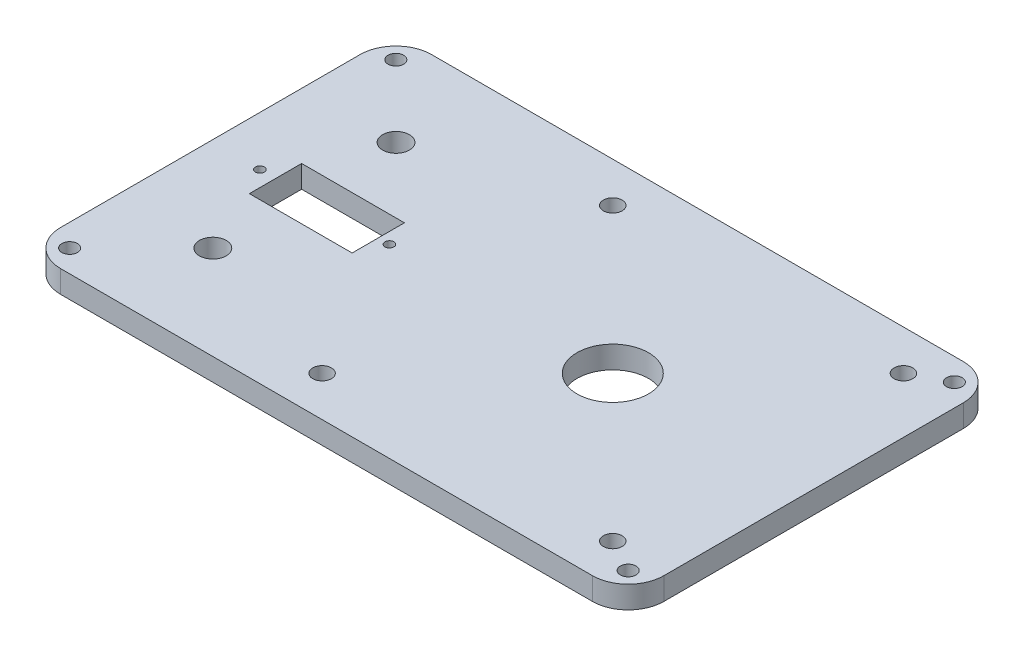
from build123d import *

# Parameters (mm, degrees)
SKETCH1_W           = 135
SKETCH1_H           = 83
SKETCH1_R           = 2.1
SKETCH1_R_2         = 8
SKETCH1_R_3         = 3
SKETCH1_R_4         = 4.725
SKETCH1_R_5         = 1.75
BOSS_EXTRUDE1_DEPTH = 5
SKETCH3_R           = 1
SKETCH3_W           = 23
SKETCH3_H           = 11.7
CUT_EXTRUDE1_DEPTH  = 80.394584198
FILLET1_R           = 8


with BuildPart() as part:
    # Sketch1 → Boss-Extrude1 (new body)
    with BuildSketch(Plane(origin=(0, 0, 0), x_dir=(1, 0, 0), z_dir=(0, 1, 0))):
        Rectangle(SKETCH1_W, SKETCH1_H)
        with Locations(Location((-9.98, 32.53, 0), (0, 0, 270))):
            Circle(SKETCH1_R, mode=Mode.SUBTRACT)
        with Locations(Location((55.08, 32.53, 0), (0, 0, 270))):
            Circle(SKETCH1_R, mode=Mode.SUBTRACT)
        with Locations(Location((55.08, -32.53, 0), (0, 0, 270))):
            Circle(SKETCH1_R, mode=Mode.SUBTRACT)
        with Locations(Location((-9.98, -32.53, 0), (0, 0, 270))):
            Circle(SKETCH1_R, mode=Mode.SUBTRACT)
        with Locations(Location((22.55, 0, 0), (0, 0, 270))):
            Circle(SKETCH1_R_2, mode=Mode.SUBTRACT)
        with Locations(Location((-46.455, 20.5, 0), (0, 0, 270))):
            Circle(SKETCH1_R_3, mode=Mode.SUBTRACT)
        with Locations(Location((-35.78, 0, 0), (0, 0, 270))):
            Circle(SKETCH1_R_4, mode=Mode.SUBTRACT)
        with Locations(Location((-46.455, -20.5, 0), (0, 0, 270))):
            Circle(SKETCH1_R_3, mode=Mode.SUBTRACT)
        with Locations(Location((-62.5, 36.5, 0), (0, 0, 270))):
            Circle(SKETCH1_R_5, mode=Mode.SUBTRACT)
        with Locations(Location((62.5, 36.5, 0), (0, 0, 270))):
            Circle(SKETCH1_R_5, mode=Mode.SUBTRACT)
        with Locations(Location((62.5, -36.5, 0), (0, 0, 270))):
            Circle(SKETCH1_R_5, mode=Mode.SUBTRACT)
        with Locations(Location((-62.5, -36.5, 0), (0, 0, 270))):
            Circle(SKETCH1_R_5, mode=Mode.SUBTRACT)
    extrude(amount=BOSS_EXTRUDE1_DEPTH)

    # Sketch3 → Cut-Extrude1 (cut, through all)
    with BuildSketch(Plane(origin=(0, 5, 0), x_dir=(1, 0, 0), z_dir=(0, 1, 0))):
        with Locations(Location((-27.43, 0, 0), (0, 0, 270))):
            Circle(SKETCH3_R)
        with Locations(Location((-56.43, 0, 0), (0, 0, 270))):
            Circle(SKETCH3_R)
        with Locations((-41.43, 0)):
            Rectangle(SKETCH3_W, SKETCH3_H)
    extrude(amount=-CUT_EXTRUDE1_DEPTH, mode=Mode.SUBTRACT)

    # Fillet1
    fillet1_edges = [part.edges().sort_by_distance(p)[0] for p in [
        (-67.5, 2.5, -41.5),
        (67.5, 2.5, -41.5),
        (67.5, 2.5, 41.5),
        (-67.5, 2.5, 41.5),
    ]]
    fillet(fillet1_edges, radius=FILLET1_R)


solid = part.part
